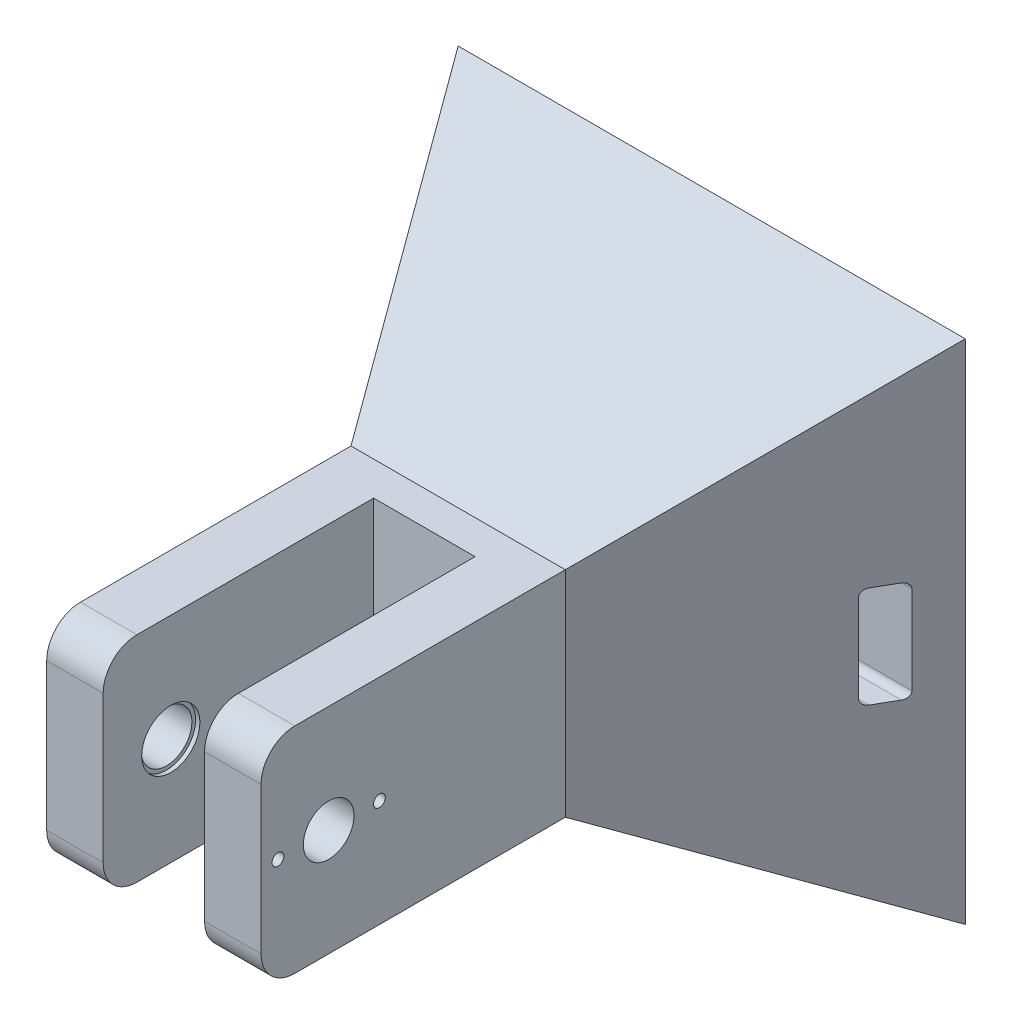
from build123d import *

# Parameters (mm, degrees)
SKETCH2_W           = 150
SKETCH2_H           = 150
BOSS_EXTRUDE1_DEPTH = 75
BOSS_EXTRUDE1_TAPER = 30
SKETCH3_W           = 63.397459622
SKETCH3_H           = 63.397459622
BOSS_EXTRUDE2_DEPTH = 90
SKETCH4_W           = 30
SKETCH4_H           = 63.397459622
CUT_EXTRUDE1_DEPTH  = 80
FILLET1_R           = 10
CUT_EXTRUDE2_REACH  = 249.204
SKETCH5_R           = 7.5
SKETCH6_W           = 100
SKETCH6_H           = 100
CUT_EXTRUDE3_DEPTH  = 20
SKETCH7_W           = 10
SKETCH7_H           = 30
CUT_EXTRUDE4_DEPTH  = 256.636460623
FILLET2_R           = 2
SKETCH8_R           = 1.75
CUT_EXTRUDE5_DEPTH  = 16.698729811
CUT_EXTRUDE6_START  = -3
SKETCH9_R           = 3.25
SKETCH9_R_2         = 1.75
CUT_EXTRUDE6_DEPTH  = 3
SKETCH10_R          = 8.6
CUT_EXTRUDE7_DEPTH  = 1.25


with BuildPart() as part:
    # Sketch2 → Boss-Extrude1 (new body)
    with BuildSketch(Plane.XY):
        with Locations((75, 75)):
            Rectangle(SKETCH2_W, SKETCH2_H)
    extrude(amount=BOSS_EXTRUDE1_DEPTH, taper=BOSS_EXTRUDE1_TAPER)

    # Sketch3 → Boss-Extrude2 (add)
    with BuildSketch(Plane.XY.offset(75)):
        with Locations((75, 75)):
            Rectangle(SKETCH3_W, SKETCH3_H)
    extrude(amount=BOSS_EXTRUDE2_DEPTH)

    # Sketch4 → Cut-Extrude1 (cut)
    with BuildSketch(Plane.XY.offset(165)):
        with Locations((75, 75)):
            Rectangle(SKETCH4_W, SKETCH4_H)
    extrude(amount=-CUT_EXTRUDE1_DEPTH, mode=Mode.SUBTRACT)

    # Fillet1
    fillet1_edges = [part.edges().sort_by_distance(p)[0] for p in [
        (98.349364905, 106.698729811, 165),
        (51.650635095, 43.301270189, 165),
        (51.650635095, 106.698729811, 165),
        (98.349364905, 43.301270189, 165),
    ]]
    fillet(fillet1_edges, radius=FILLET1_R)

    # Cut-Extrude2: up to this face of the body (flat: up to its plane)
    cut_extrude2_end = Plane(part.part.faces().sort_by_distance((106.698729811, 75, 119.675861825))[0])
    # Sketch5 → Cut-Extrude2 (cut, up to the picked face)
    with BuildSketch(Plane.ZY.offset(-43.301270189), mode=Mode.PRIVATE) as cut_extrude2_sk1:
        with Locations((145, 75)):
            Circle(SKETCH5_R)
    cut_extrude2_tool1 = split(extrude(cut_extrude2_sk1.sketch, amount=-CUT_EXTRUDE2_REACH, mode=Mode.PRIVATE), bisect_by=cut_extrude2_end, keep=Keep.BOTH, mode=Mode.PRIVATE)
    add(cut_extrude2_tool1.solids().sort_by(Axis((43.30127, 75, 145), (1, 0, 0)))[0], mode=Mode.SUBTRACT)

    # Sketch6 → Cut-Extrude3 (cut)
    with BuildSketch(Plane(origin=(0, 0, 0), x_dir=(-1, 0, 0), z_dir=(0, 0, -1))):
        with Locations((-75, 75)):
            Rectangle(SKETCH6_W, SKETCH6_H)
    extrude(amount=-CUT_EXTRUDE3_DEPTH, mode=Mode.SUBTRACT)

    # Sketch7 → Cut-Extrude4 (cut, through all)
    with BuildSketch(Plane.ZY.offset(-125)):
        with Locations((15, 75)):
            Rectangle(SKETCH7_W, SKETCH7_H)
    extrude(amount=-CUT_EXTRUDE4_DEPTH, mode=Mode.SUBTRACT)

    # Fillet2
    fillet2_edges = [part.edges().sort_by_distance(p)[0] for p in [
        (131.726497308, 90, 20),
        (131.726497308, 60, 20),
        (134.613248654, 60, 10),
        (134.613248654, 90, 10),
    ]]
    fillet(fillet2_edges, radius=FILLET2_R)

    # Sketch8 → Cut-Extrude5 (cut)
    with BuildSketch(Plane(origin=(106.698729811, 0, 0), x_dir=(0, 0, -1), z_dir=(1, 0, 0))):
        with Locations((-160, 75)):
            Circle(SKETCH8_R)
        with Locations((-130, 75)):
            Circle(SKETCH8_R)
    extrude(amount=-CUT_EXTRUDE5_DEPTH, mode=Mode.SUBTRACT)

    # Sketch9 → Cut-Extrude6 (cut)
    # profile 1 of 2: a face of its own
    with BuildSketch(Plane.ZY.offset(-90).offset(CUT_EXTRUDE6_START)):
        with Locations(Location((160, 75, 0), (0, 0, 270))):
            Circle(SKETCH9_R)
        with Locations(Location((160, 75, 0), (0, 0, 180))):
            Circle(SKETCH9_R_2, mode=Mode.SUBTRACT)
    # profile 2 of 2: a face of its own
    with BuildSketch(Plane.ZY.offset(-90).offset(CUT_EXTRUDE6_START)):
        with Locations(Location((130, 75, 0), (0, 0, 270))):
            Circle(SKETCH9_R)
        with Locations(Location((130, 75, 0), (0, 0, 180))):
            Circle(SKETCH9_R_2, mode=Mode.SUBTRACT)
    extrude(amount=CUT_EXTRUDE6_DEPTH, mode=Mode.SUBTRACT)

    # Sketch10 → Cut-Extrude7 (cut)
    with BuildSketch(Plane(origin=(60, 0, 0), x_dir=(0, 0, -1), z_dir=(1, 0, 0))):
        with Locations(Location((-145, 75, 0), (0, 0, 90))):
            Circle(SKETCH10_R)
    cut_extrude7 = extrude(amount=-CUT_EXTRUDE7_DEPTH, mode=Mode.SUBTRACT)

    # Mirror1: Cut-Extrude7 across plane
    add(cut_extrude7.mirror(Plane(origin=(75, 0, 0), x_dir=(0, 0, 1), z_dir=(1, 0, 0))), mode=Mode.SUBTRACT)


solid = part.part
